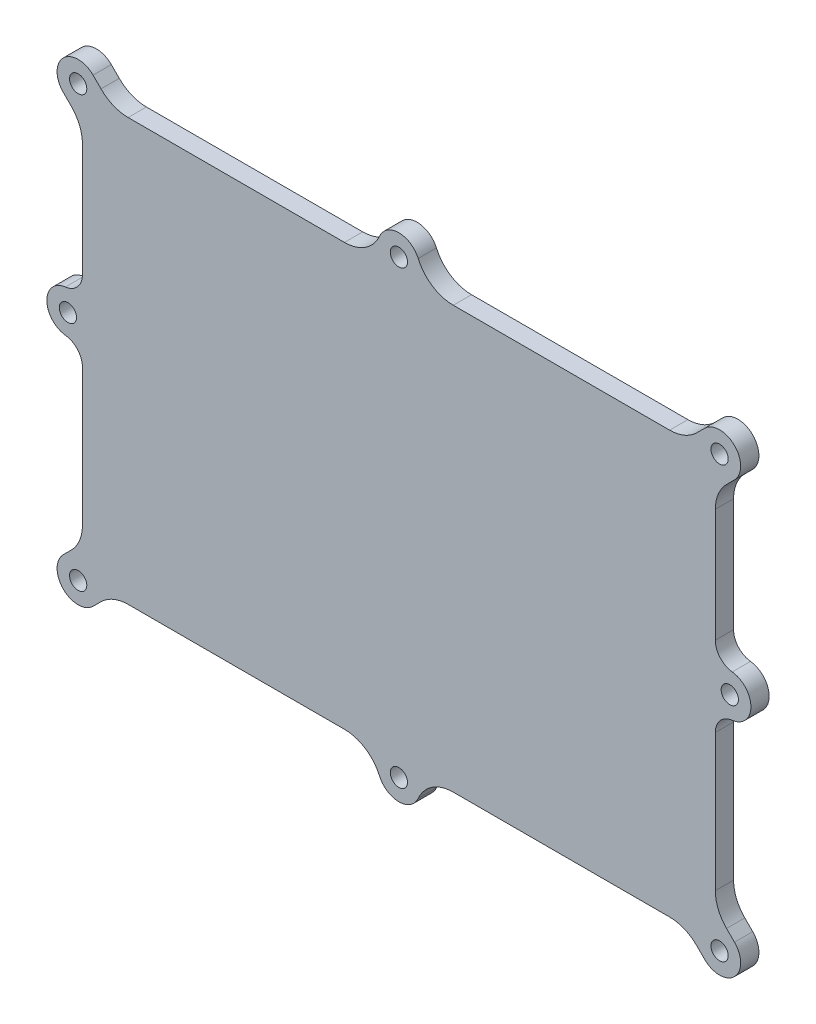
from build123d import *

# Parameters (mm, degrees)
BOSS_EXTRUDE1_DEPTH  = 4.7625
M4_CLEARANCE_HOLE1_D = 4.5


with BuildPart() as part:
    # Sketch2 → Boss-Extrude1 (new body)
    with BuildSketch(Plane.XY):
        with BuildLine():
            Line((183.553261784, 104.332754576), (181.480626284, 102.260119075))
            ThreePointArc((181.480626284, 102.260119075), (178.236392795, 100.092391562), (174.409558472, 99.331186887))
            Line((174.409558472, 99.331186887), (117.978290457, 99.331186887))
            ThreePointArc((117.978290457, 99.331186887), (112.506161662, 100.961252213), (108.818018348, 105.320025597))
            ThreePointArc((108.818018348, 105.320025597), (103.779868689, 108.613886887), (98.741719029, 105.320025597))
            ThreePointArc((98.741719029, 105.320025597), (95.053575715, 100.961252213), (89.58144692, 99.331186887))
            Line((89.58144692, 99.331186887), (33.150178905, 99.331186887))
            ThreePointArc((33.150178905, 99.331186887), (29.323344582, 100.092391562), (26.079111093, 102.260119075))
            Line((26.079111093, 102.260119075), (24.006475593, 104.332754576))
            ThreePointArc((24.006475593, 104.332754576), (16.228301, 104.332754576), (16.228301, 96.554579982))
            Line((16.228301, 96.554579982), (18.3009365, 94.481944482))
            ThreePointArc((18.3009365, 94.481944482), (20.468664014, 91.237710994), (21.229868689, 87.41087667))
            Line((21.229868689, 87.41087667), (21.229868689, 57.840075139))
            ThreePointArc((21.229868689, 57.840075139), (19.964727008, 54.515795769), (16.809535355, 52.873790154))
            ThreePointArc((16.809535355, 52.873790154), (11.947168689, 47.41087667), (16.809535355, 41.947963186))
            ThreePointArc((16.809535355, 41.947963186), (19.964727008, 40.305957571), (21.229868689, 36.981678201))
            Line((21.229868689, 36.981678201), (21.229868689, 1.251497104))
            ThreePointArc((21.229868689, 1.251497104), (20.468664014, -2.57533722), (18.3009365, -5.819570708))
            Line((18.3009365, -5.819570708), (16.228301, -7.892206209))
            ThreePointArc((16.228301, -7.892206209), (16.228301, -15.670380802), (24.006475593, -15.670380802))
            Line((24.006475593, -15.670380802), (26.079111093, -13.597745301))
            ThreePointArc((26.079111093, -13.597745301), (29.323344582, -11.430017788), (33.150178905, -10.668813113))
            Line((33.150178905, -10.668813113), (89.58144692, -10.668813113))
            ThreePointArc((89.58144692, -10.668813113), (95.053575715, -12.298878439), (98.741719029, -16.657651823))
            ThreePointArc((98.741719029, -16.657651823), (103.779868689, -19.951513113), (108.818018348, -16.657651823))
            ThreePointArc((108.818018348, -16.657651823), (112.506161662, -12.298878439), (117.978290457, -10.668813113))
            Line((117.978290457, -10.668813113), (174.409558472, -10.668813113))
            ThreePointArc((174.409558472, -10.668813113), (178.236392795, -11.430017788), (181.480626284, -13.597745301))
            Line((181.480626284, -13.597745301), (183.553261784, -15.670380802))
            ThreePointArc((183.553261784, -15.670380802), (191.331436377, -15.670380802), (191.331436377, -7.892206209))
            Line((191.331436377, -7.892206209), (189.258800877, -5.819570708))
            ThreePointArc((189.258800877, -5.819570708), (187.091073363, -2.57533722), (186.329868689, 1.251497104))
            Line((186.329868689, 1.251497104), (186.329868689, 36.981678201))
            ThreePointArc((186.329868689, 36.981678201), (187.595010369, 40.305957571), (190.750202022, 41.947963186))
            ThreePointArc((190.750202022, 41.947963186), (195.612568689, 47.41087667), (190.750202022, 52.873790154))
            ThreePointArc((190.750202022, 52.873790154), (187.595010369, 54.515795769), (186.329868689, 57.840075139))
            Line((186.329868689, 57.840075139), (186.329868689, 87.41087667))
            ThreePointArc((186.329868689, 87.41087667), (187.091073363, 91.237710994), (189.258800877, 94.481944482))
            Line((189.258800877, 94.481944482), (191.331436377, 96.554579982))
            ThreePointArc((191.331436377, 96.554579982), (191.331436377, 104.332754576), (183.553261784, 104.332754576))
        make_face()
    extrude(amount=BOSS_EXTRUDE1_DEPTH)

    # M4 Clearance Hole1 (through all)
    with Locations(Plane.XY.offset(4.7625)):
        with Locations((17.447168689, 47.41087667), (20.117388296, 100.443667279), (103.779868689, 103.113886887), (187.442349081, 100.443667279), (190.112568689, 47.41087667), (187.442349081, -11.781293505), (103.779868689, -14.451513113), (20.117388296, -11.781293505)):
            Hole(M4_CLEARANCE_HOLE1_D / 2)


solid = part.part
